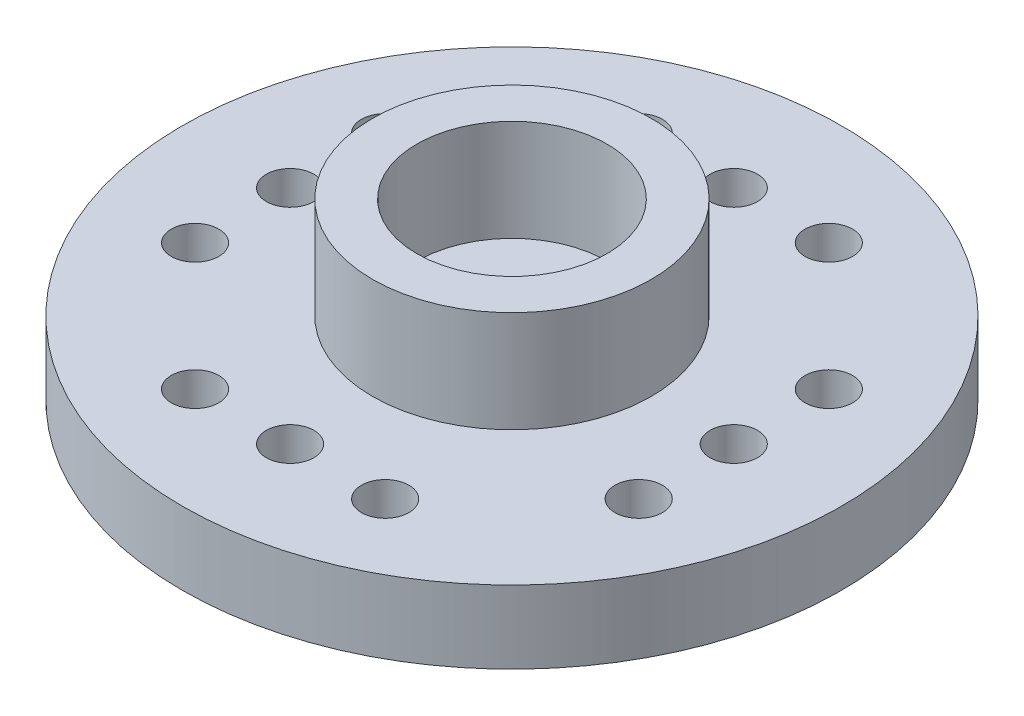
from build123d import *

# Parameters (mm, degrees)
SKETCH1_R           = 10.4
SKETCH1_R_2         = 0.75
SKETCH1_R_3         = 1.5
BOSS_EXTRUDE1_DEPTH = 2.3
SKETCH2_R           = 4.4
SKETCH2_R_2         = 3
BOSS_EXTRUDE2_DEPTH = 3.2


with BuildPart() as part:
    # Sketch1 → Boss-Extrude1 (new body)
    with BuildSketch(Plane(origin=(0, 0, 0), x_dir=(1, 0, 0), z_dir=(0, 1, 0))):
        with Locations(Location((0, 0, 0), (0, 0, 270))):
            Circle(SKETCH1_R)
        with Locations(Location((7, 0, 0), (0, 0, 270))):
            Circle(SKETCH1_R_2, mode=Mode.SUBTRACT)
        with Locations(Location((7, 3, 0), (0, 0, 270))):
            Circle(SKETCH1_R_2, mode=Mode.SUBTRACT)
        with Locations(Location((7, -3, 0), (0, 0, 270))):
            Circle(SKETCH1_R_2, mode=Mode.SUBTRACT)
        with Locations(Location((3, -7, 0), (0, 0, 90))):
            Circle(SKETCH1_R_2, mode=Mode.SUBTRACT)
        with Locations(Location((0, -7, 0), (0, 0, 90))):
            Circle(SKETCH1_R_2, mode=Mode.SUBTRACT)
        with Locations(Location((-3, -7, 0), (0, 0, 90))):
            Circle(SKETCH1_R_2, mode=Mode.SUBTRACT)
        with Locations(Location((-7, -3, 0), (0, 0, 270))):
            Circle(SKETCH1_R_2, mode=Mode.SUBTRACT)
        with Locations(Location((-7, 0, 0), (0, 0, 270))):
            Circle(SKETCH1_R_2, mode=Mode.SUBTRACT)
        with Locations(Location((-7, 3, 0), (0, 0, 270))):
            Circle(SKETCH1_R_2, mode=Mode.SUBTRACT)
        with Locations(Location((-3, 7, 0), (0, 0, 90))):
            Circle(SKETCH1_R_2, mode=Mode.SUBTRACT)
        with Locations(Location((0, 7, 0), (0, 0, 90))):
            Circle(SKETCH1_R_2, mode=Mode.SUBTRACT)
        with Locations(Location((3, 7, 0), (0, 0, 90))):
            Circle(SKETCH1_R_2, mode=Mode.SUBTRACT)
        with Locations(Location((0, 0, 0), (0, 0, 270))):
            Circle(SKETCH1_R_3, mode=Mode.SUBTRACT)
    extrude(amount=BOSS_EXTRUDE1_DEPTH)

    # Sketch2 → Boss-Extrude2 (add)
    with BuildSketch(Plane(origin=(0, 2.3, 0), x_dir=(1, 0, 0), z_dir=(0, 1, 0))):
        with Locations(Location((0, 0, 0), (0, 0, 270))):
            Circle(SKETCH2_R)
        with Locations(Location((0, 0, 0), (0, 0, 270))):
            Circle(SKETCH2_R_2, mode=Mode.SUBTRACT)
    extrude(amount=BOSS_EXTRUDE2_DEPTH)


solid = part.part
